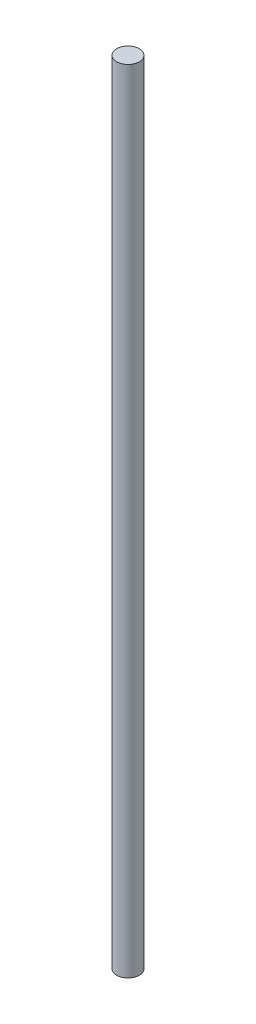
from build123d import *

# Parameters (mm, degrees)
SKETCH_1_R      = 0.5
EXTRUDE_1_DEPTH = 35


with BuildPart() as part:
    # 草图1 → 凸台-拉伸1 (new body)
    with BuildSketch(Plane(origin=(0, 0, 0), x_dir=(1, 0, 0), z_dir=(0, 1, 0))):
        with Locations(Location((0, 0, 0), (0, 0, 270))):
            Circle(SKETCH_1_R)
    extrude(amount=EXTRUDE_1_DEPTH)


solid = part.part
